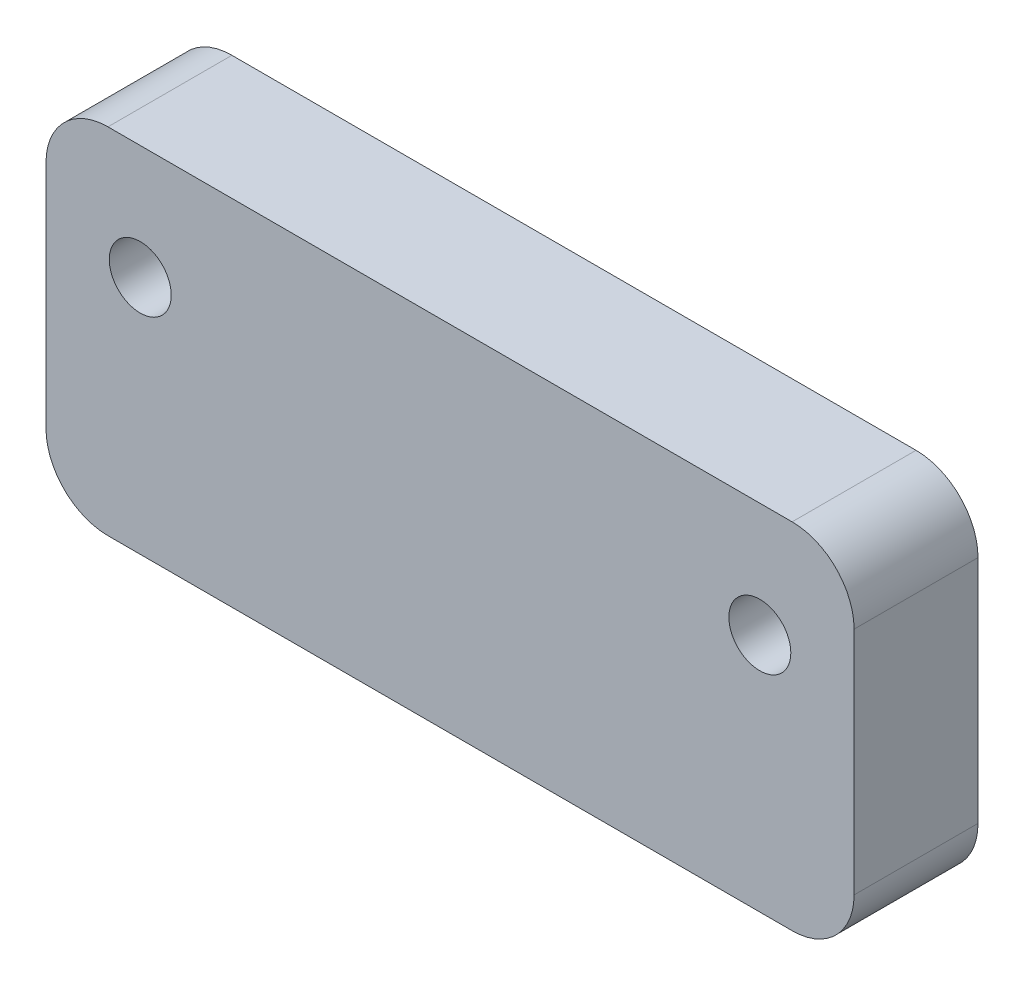
from build123d import *

# Parameters (mm, degrees)
SKETCH1_R           = 2.5
BOSS_EXTRUDE1_DEPTH = 10


with BuildPart() as part:
    # Sketch1 → Boss-Extrude1 (new body)
    with BuildSketch(Plane.XY):
        with BuildLine():
            Line((37.464654401, -75.852024497), (92.675345599, -75.852024497))
            ThreePointArc((92.675345599, -75.852024497), (96.210879505, -77.316490591), (97.675345599, -80.852024497))
            Line((97.675345599, -80.852024497), (97.675345599, -99.426914696))
            ThreePointArc((97.675345599, -99.426914696), (96.210879505, -102.962448602), (92.675345599, -104.426914696))
            Line((92.675345599, -104.426914696), (37.464654401, -104.426914696))
            ThreePointArc((37.464654401, -104.426914696), (33.929120495, -102.962448602), (32.464654401, -99.426914696))
            Line((32.464654401, -99.426914696), (32.464654401, -80.852024497))
            ThreePointArc((32.464654401, -80.852024497), (33.929120495, -77.316490591), (37.464654401, -75.852024497))
        make_face()
        with Locations((90.07, -85.065581077)):
            Circle(SKETCH1_R, mode=Mode.SUBTRACT)
        with Locations((40.07, -85.065581077)):
            Circle(SKETCH1_R, mode=Mode.SUBTRACT)
    extrude(amount=BOSS_EXTRUDE1_DEPTH)


solid = part.part
